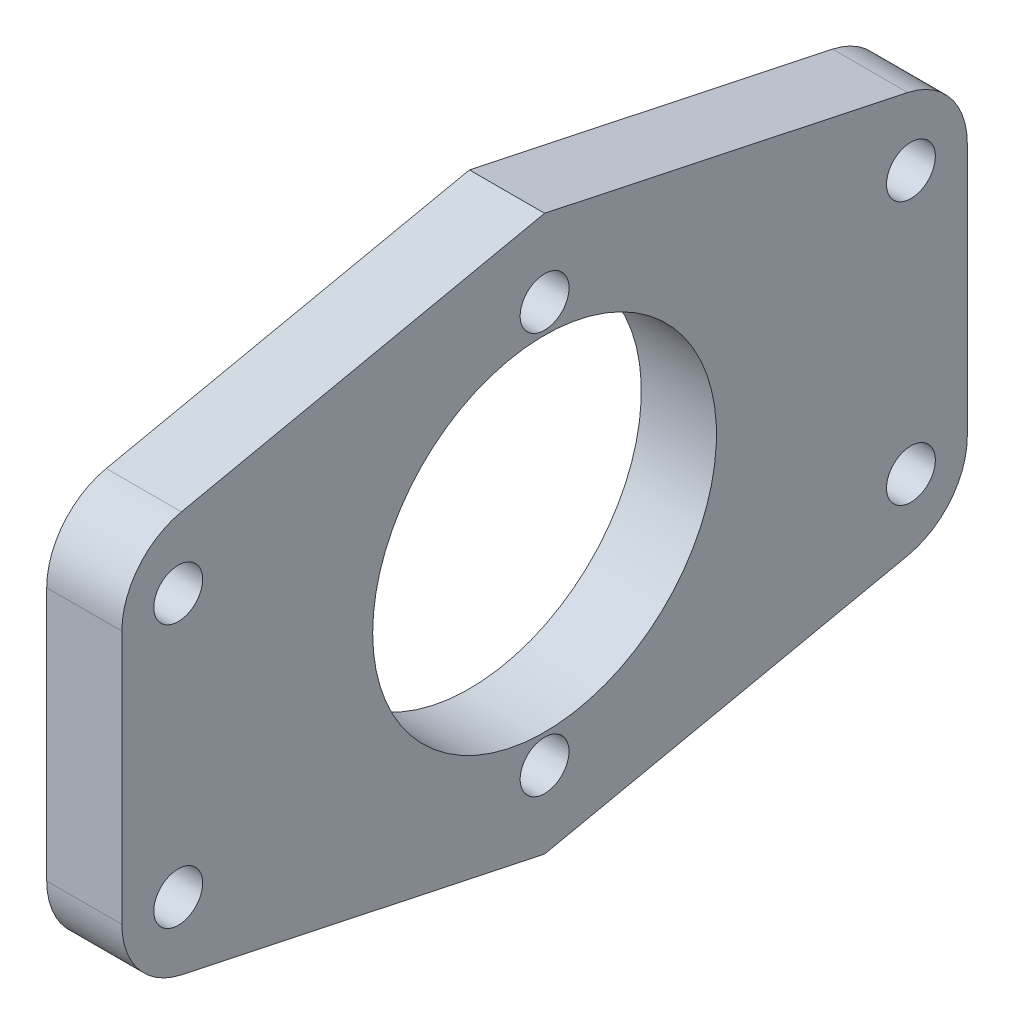
from build123d import *

# Parameters (mm, degrees)
SKETCH1_R           = 1.3
BOSS_EXTRUDE1_DEPTH = 4
SKETCH2_R           = 9.15
CUT_EXTRUDE1_DEPTH  = 52.522207254
FILLET1_R           = 4


with BuildPart() as part:
    # Sketch1 → Boss-Extrude1 (new body)
    with BuildSketch(Plane(origin=(0, 0, 0), x_dir=(0, 0, -1), z_dir=(1, 0, 0))):
        Polygon((45, 0), (22.5, 4.769696007), (0, 0), (0, -20), (22.5, -24.769696007), (45, -20), align=None)
        with Locations((22.5, 0.680807118)):
            Circle(SKETCH1_R, mode=Mode.SUBTRACT)
        with Locations((22.5, -20.680807118)):
            Circle(SKETCH1_R, mode=Mode.SUBTRACT)
        with Locations((42, -3)):
            Circle(SKETCH1_R, mode=Mode.SUBTRACT)
        with Locations((3, -3)):
            Circle(SKETCH1_R, mode=Mode.SUBTRACT)
        with Locations((3, -17)):
            Circle(SKETCH1_R, mode=Mode.SUBTRACT)
        with Locations((42, -17)):
            Circle(SKETCH1_R, mode=Mode.SUBTRACT)
    extrude(amount=BOSS_EXTRUDE1_DEPTH)

    # Sketch2 → Cut-Extrude1 (cut, through all)
    with BuildSketch(Plane.ZY):
        with Locations((-22.5, -10)):
            Circle(SKETCH2_R)
    extrude(amount=-CUT_EXTRUDE1_DEPTH, mode=Mode.SUBTRACT)

    # Fillet1
    fillet1_edges = [part.edges().sort_by_distance(p)[0] for p in [
        (2, -20, 0),
        (2, 0, 0),
        (2, 0, -45),
        (2, -20, -45),
    ]]
    fillet(fillet1_edges, radius=FILLET1_R)


solid = part.part
